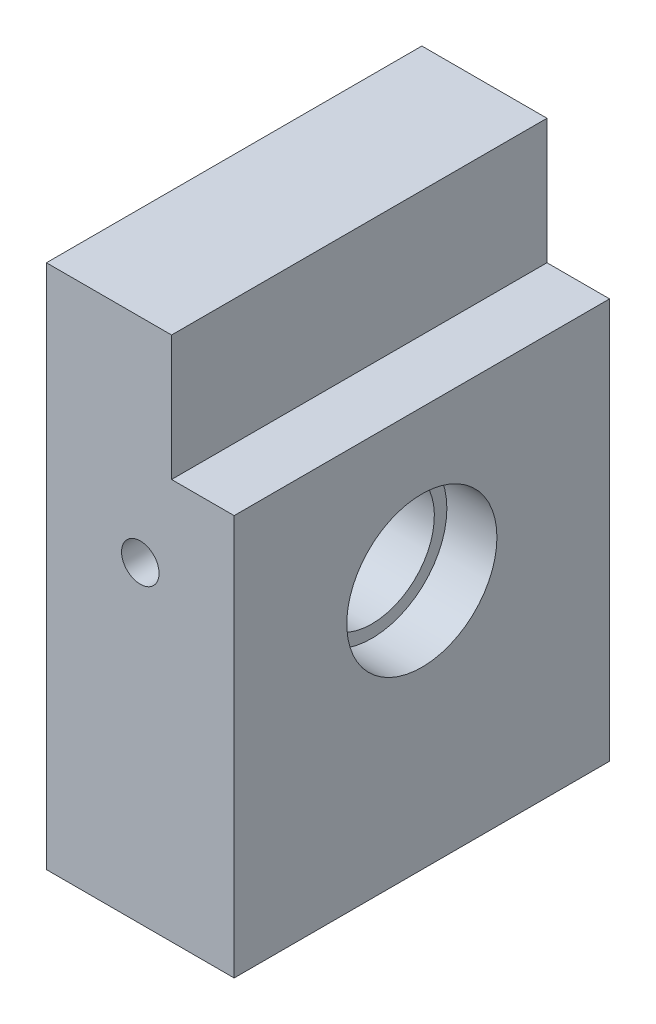
from build123d import *

# Parameters (mm, degrees)
RESSALTO_EXTRUS_O1_DEPTH = 30
ESBO_O4_R                = 6
CORTE_EXTRUS_O1_DEPTH    = 4
ESBO_O5_R                = 5
CORTE_EXTRUS_O2_DEPTH    = 11
ESBO_O6_R                = 1.5
CORTE_EXTRUS_O3_DEPTH    = 54.749418602
ESBO_O7_R                = 2.5
CORTE_EXTRUS_O4_DEPTH    = 9
ESBO_O8_R                = 2
CORTE_EXTRUS_O5_DEPTH    = 11


with BuildPart() as part:
    # Esboço2 → Ressalto-extrusão1 (new body)
    with BuildSketch(Plane.XY):
        Polygon((0, 0), (0, -42), (15, -42), (15, -10), (10, -10), (10, 0), align=None)
    extrude(amount=RESSALTO_EXTRUS_O1_DEPTH)

    # Esboço4 → Corte-extrusão1 (cut)
    with BuildSketch(Plane(origin=(15, 0, 0), x_dir=(0, 0, -1), z_dir=(1, 0, 0))):
        with Locations((-15, -22)):
            Circle(ESBO_O4_R)
    extrude(amount=-CORTE_EXTRUS_O1_DEPTH, mode=Mode.SUBTRACT)

    # Esboço5 → Corte-extrusão2 (cut)
    with BuildSketch(Plane.ZY):
        with Locations(Location((15, -22, 0), (0, 0, 270))):
            Circle(ESBO_O5_R)
    extrude(amount=-CORTE_EXTRUS_O2_DEPTH, mode=Mode.SUBTRACT)

    # Esboço6 → Corte-extrusão3 (cut, through all)
    with BuildSketch(Plane.XY.offset(30)):
        with Locations((7.5, -17)):
            Circle(ESBO_O6_R)
    extrude(amount=-CORTE_EXTRUS_O3_DEPTH, mode=Mode.SUBTRACT)

    # Esboço7 → Corte-extrusão4 (cut)
    with BuildSketch(Plane.XZ.offset(42)):
        with Locations(Location((7.097716039, 24, 0), (0, 0, 270))):
            Circle(ESBO_O7_R)
        with Locations(Location((7.097716039, 6, 0), (0, 0, 270))):
            Circle(ESBO_O7_R)
    extrude(amount=-CORTE_EXTRUS_O4_DEPTH, mode=Mode.SUBTRACT)

    # Esboço8 → Corte-extrusão5 (cut)
    with BuildSketch(Plane.XZ.offset(42)):
        with Locations(Location((7.097716039, 24, 0), (0, 0, 270))):
            Circle(ESBO_O8_R)
        with Locations(Location((7.097716039, 6, 0), (0, 0, 270))):
            Circle(ESBO_O8_R)
    extrude(amount=-CORTE_EXTRUS_O5_DEPTH, mode=Mode.SUBTRACT)


solid = part.part
